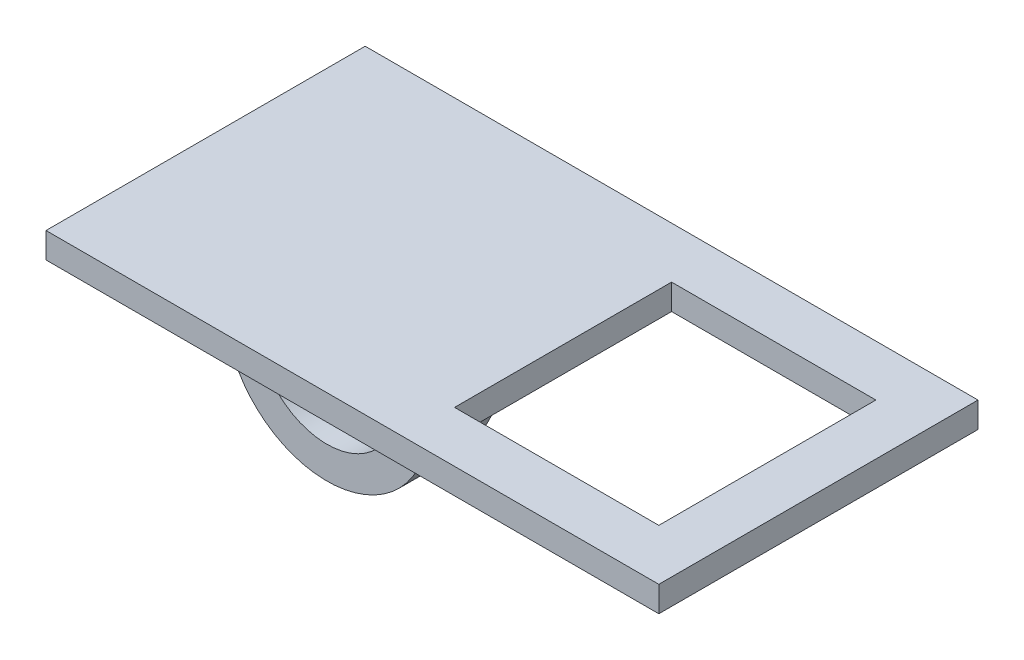
from build123d import *

# Parameters (mm, degrees)
SKETCH_1_W          = 48
SKETCH_1_H          = 25
EXTRUDE_1_DEPTH     = 2
EXTRUDE_2_DEPTH     = 2.5
SKETCH_6_W          = 16
SKETCH_6_H          = 17
CUT_EXTRUDE_3_DEPTH = 4


with BuildPart() as part:
    # Эскиз1 → Бобышка-Вытянуть1 (new body)
    with BuildSketch(Plane(origin=(0, 0, 0), x_dir=(1, 0, 0), z_dir=(0, 1, 0))):
        Rectangle(SKETCH_1_W, SKETCH_1_H)
    extrude(amount=EXTRUDE_1_DEPTH)

    # Эскиз6 → Вырез-Вытянуть3 (cut)
    with BuildSketch(Plane.XZ):
        with Locations((12, 0)):
            Rectangle(SKETCH_6_W, SKETCH_6_H)
    extrude(amount=-CUT_EXTRUDE_3_DEPTH, mode=Mode.SUBTRACT)


with BuildPart() as body_2:
    # Эскиз2 → Бобышка-Вытянуть2 (new, symmetric)
    with BuildSketch(Plane.XY):
        with BuildLine():
            Line((-17.291502622, 0), (-24, 0))
            Line((-24, 0), (-23.483738935, -5.336991148))
            ThreePointArc((-23.483738935, -5.336991148), (-22.126337231, -2.219947845), (-18.762628152, -1.726025213))
            ThreePointArc((-18.762628152, -1.726025213), (-18.088539064, -0.810617372), (-17.291502622, 0))
        make_face()
        with BuildLine():
            Line((0, 0), (-6.708497378, 0))
            ThreePointArc((-6.708497378, 0), (-4.143798842, -4.489998884), (-4.861245436, -9.610842461))
            Line((-4.861245436, -9.610842461), (0, 0))
        make_face()
        with BuildLine():
            ThreePointArc((-18.762628152, -1.726025213), (-22.126337231, -2.219947845), (-23.483738935, -5.336991148))
            ThreePointArc((-23.483738935, -5.336991148), (-22.203124072, -7.719603707), (-19.606602618, -8.477820941))
            ThreePointArc((-19.606602618, -8.477820941), (-19.857963532, -7.500802829), (-19.984364814, -6.499918511))
            ThreePointArc((-19.984364814, -6.499918511), (-21.488416815, -4.813947898), (-19.615635186, -3.550081489))
            ThreePointArc((-19.615635186, -3.550081489), (-19.24675165, -2.611107773), (-18.762628152, -1.726025213))
        make_face()
        with BuildLine():
            ThreePointArc((-16.867376933, -3.439015464), (-17.653130214, -2.403424908), (-18.762628152, -1.726025213))
            ThreePointArc((-18.762628152, -1.726025213), (-19.24675165, -2.611107773), (-19.615635186, -3.550081489))
            ThreePointArc((-19.615635186, -3.550081489), (-18.811188152, -4.085272505), (-18.5, -5))
            ThreePointArc((-18.5, -5), (-18.933826285, -6.055117818), (-19.984364814, -6.499918511))
            ThreePointArc((-19.984364814, -6.499918511), (-19.857963532, -7.500802829), (-19.606602618, -8.477820941))
            ThreePointArc((-19.606602618, -8.477820941), (-18.364498538, -8.094371498), (-17.348007682, -7.284061459))
            ThreePointArc((-17.348007682, -7.284061459), (-17.457528322, -5.31780896), (-16.867376933, -3.439015464))
        make_face()
        with BuildLine():
            Line((-6.708497378, 0), (-17.291502622, 0))
            ThreePointArc((-17.291502622, 0), (-18.088539064, -0.810617372), (-18.762628152, -1.726025213))
            ThreePointArc((-18.762628152, -1.726025213), (-17.653130214, -2.403424908), (-16.867376933, -3.439015464))
            ThreePointArc((-16.867376933, -3.439015464), (-10.681018031, -0.660497536), (-6.5, -6))
            ThreePointArc((-6.5, -6), (-11.353487144, -11.461869746), (-17.348007682, -7.284061459))
            ThreePointArc((-17.348007682, -7.284061459), (-18.364498538, -8.094371498), (-19.606602618, -8.477820941))
            ThreePointArc((-19.606602618, -8.477820941), (-12.612906919, -13.976487016), (-4.861245436, -9.610842461))
            ThreePointArc((-4.861245436, -9.610842461), (-4.143798842, -4.489998884), (-6.708497378, 0))
        make_face()
    extrude(amount=EXTRUDE_2_DEPTH, both=True)


solid = Compound([part.part, body_2.part])
